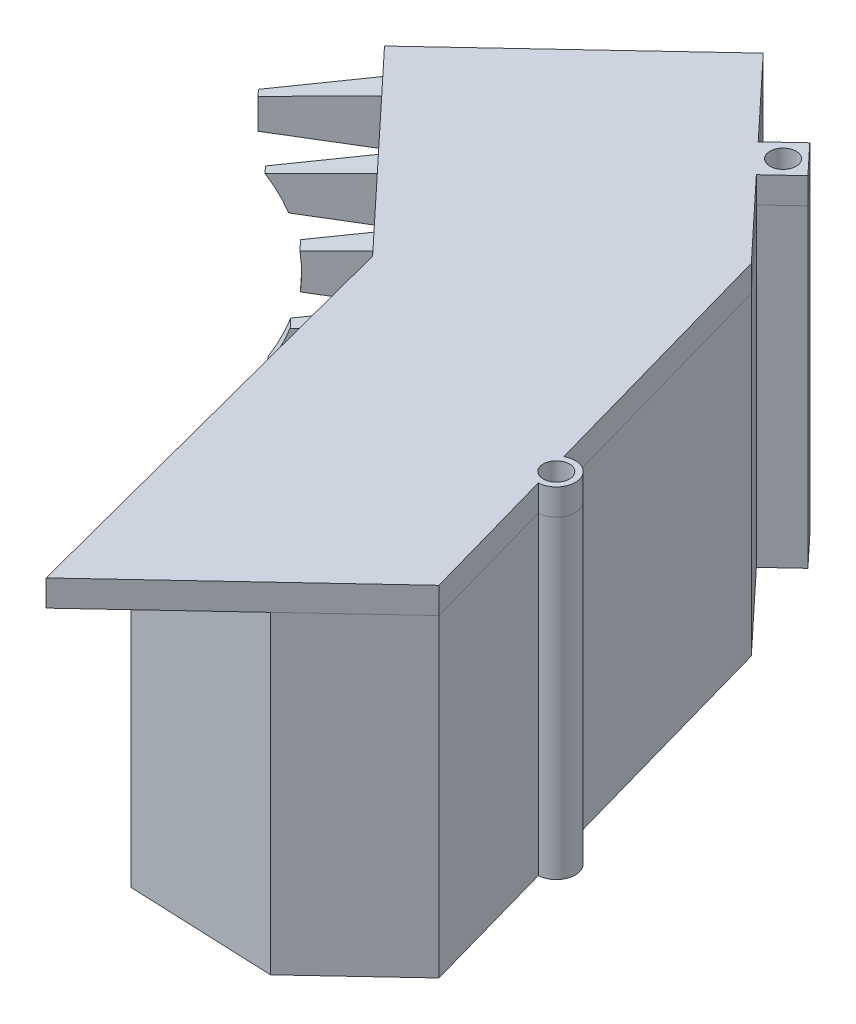
from build123d import *

# Parameters (mm, degrees)
SKETCH1_R                     = 3.175
BOSS_EXTRUDE2_DEPTH           = 76.2
SKETCH1_5_R                   = 3.175
BOSS_EXTRUDE3_DEPTH           = 6.35
SKETCH5_R                     = 3.175
BOSS_EXTRUDE4_DEPTH           = 6.35
SKETCH6_W                     = 50.8
SKETCH6_H                     = 50.8
CUT_EXTRUDE1_DEPTH            = 21.59
SKETCH7_W                     = 5.86068256
SKETCH7_H                     = 11.122345704
BOSS_EXTRUDE5_DEPTH           = 21.59
BOSS_EXTRUDE5_DRAFT           = 5
BOSS_EXTRUDE5_PROFILE_2_DEPTH = 21.59
BOSS_EXTRUDE5_PROFILE_2_DRAFT = 5
BOSS_EXTRUDE5_PROFILE_3_DEPTH = 21.59
BOSS_EXTRUDE5_PROFILE_3_DRAFT = 5
SKETCH7_H_2                   = 11.122345705
BOSS_EXTRUDE5_PROFILE_4_DEPTH = 21.59
BOSS_EXTRUDE5_PROFILE_4_DRAFT = 5
BOSS_EXTRUDE5_PROFILE_5_DEPTH = 21.59
BOSS_EXTRUDE5_PROFILE_5_DRAFT = 5
SKETCH10_R                    = 36.051864109
CUT_EXTRUDE2_DEPTH            = 21.59
CUT_EXTRUDE3_START            = -5.08
SKETCH11_W                    = 102.376221927
SKETCH11_H                    = 148.639543751
CUT_EXTRUDE3_DEPTH            = 33.02


with BuildPart() as part:
    # Sketch1 → Boss-Extrude2 (new body)
    with BuildSketch(Plane(origin=(0, 0, 0), x_dir=(1, 0, 0), z_dir=(0, 1, 0))):
        with BuildLine():
            Line((-4.208751998, -43.475305064), (45.017746951, 2.631829887))
            Line((45.017746951, 2.631829887), (35.550660053, 36.209226482))
            ThreePointArc((35.550660053, 36.209226482), (39.762177432, 42.05307025), (33.11828595, 44.83625091))
            Line((33.11828595, 44.83625091), (15.243844224, 108.232438689))
            Line((15.243844224, 108.232438689), (-2.783728935, 127.479661752))
            Line((-2.783728935, 127.479661752), (3.678966496, 133.532831827))
            Line((3.678966496, 133.532831827), (-3.005742225, 140.669792455))
            Line((-3.005742225, 140.669792455), (-9.468437655, 134.61662238))
            Line((-9.468437655, 134.61662238), (-27.496010814, 153.863845442))
            Line((-27.496010814, 153.863845442), (-74.966911398, 109.401060841))
            Line((-74.966911398, 109.401060841), (-32.227053049, 63.769650553))
            Line((-32.227053049, 63.769650553), (-4.208751998, -43.475305064))
        make_face()
        with Locations((35.334305242, 40.804639607)):
            Circle(SKETCH1_R, mode=Mode.SUBTRACT)
        with BuildLine():
            Line((-27.946524097, 65.532765046), (-68.844709626, 109.197904706))
            Line((-68.844709626, 109.197904706), (-27.496010814, 147.926436632))
            Line((-27.496010814, 147.926436632), (12.111157264, 105.390011693))
            Line((12.111157264, 105.390011693), (34.544848217, 24.491577435))
            ThreePointArc((34.544848217, 24.491577435), (36.285698832, 19.303992732), (36.875100326, 13.863937421))
            ThreePointArc((36.875100326, 13.863937421), (14.585843996, -11.34485616), (-13.162952731, 7.689284266))
            Line((-13.162952731, 7.689284266), (-27.946524097, 65.532765046))
        make_face(mode=Mode.SUBTRACT)
        with Locations((-2.894634056, 134.074815557)):
            Circle(SKETCH1_R, mode=Mode.SUBTRACT)
    extrude(amount=BOSS_EXTRUDE2_DEPTH)

    # Sketch1<5> → Boss-Extrude3 (add)
    with BuildSketch(Plane(origin=(0, 0, 0), x_dir=(1, 0, 0), z_dir=(0, 1, 0))):
        with BuildLine():
            Line((-27.496010814, 147.926436632), (-68.844709626, 109.197904706))
            Line((-68.844709626, 109.197904706), (-27.946524097, 65.532765046))
            Line((-27.946524097, 65.532765046), (-13.162952731, 7.689284266))
            ThreePointArc((-13.162952731, 7.689284266), (3.03743719, 37.821521623), (34.544848217, 24.491577435))
            Line((34.544848217, 24.491577435), (12.111157264, 105.390011693))
            Line((12.111157264, 105.390011693), (-27.496010814, 147.926436632))
        make_face()
        with Locations((-32.808552916, 77.429328599)):
            Circle(SKETCH1_5_R, mode=Mode.SUBTRACT)
        with Locations((-1.199981142, 109.041759799)):
            Circle(SKETCH1_5_R, mode=Mode.SUBTRACT)
    extrude(amount=BOSS_EXTRUDE3_DEPTH)

    # Sketch6 → Cut-Extrude1 (cut)
    with BuildSketch(Plane(origin=(14.64974053, 0, -13.721421958), x_dir=(0.683604049055853, 0, 0.729853070223345), z_dir=(-0.729853070223345, 0, 0.683604049055853))):
        with Locations((-99.833701757, 41.275)):
            Rectangle(SKETCH6_W, SKETCH6_H)
    extrude(amount=-CUT_EXTRUDE1_DEPTH, mode=Mode.SUBTRACT)


with BuildPart() as body_2:
    # Sketch5 → Boss-Extrude4 (new body)
    with BuildSketch(Plane(origin=(0, 76.2, 0), x_dir=(1, 0, 0), z_dir=(0, 1, 0))):
        with BuildLine():
            Line((45.017746951, 2.631829887), (35.550660053, 36.209226482))
            ThreePointArc((35.550660053, 36.209226482), (39.762177432, 42.05307025), (33.11828595, 44.83625091))
            Line((33.11828595, 44.83625091), (15.243844224, 108.232438689))
            Line((15.243844224, 108.232438689), (-2.783728935, 127.479661752))
            Line((-2.783728935, 127.479661752), (3.678966496, 133.532831827))
            Line((3.678966496, 133.532831827), (-3.005742225, 140.669792455))
            Line((-3.005742225, 140.669792455), (-9.468437655, 134.61662238))
            Line((-9.468437655, 134.61662238), (-27.496010814, 153.863845442))
            Line((-27.496010814, 153.863845442), (-74.966911398, 109.401060841))
            Line((-74.966911398, 109.401060841), (-32.227053049, 63.769650553))
            Line((-32.227053049, 63.769650553), (-4.208751998, -43.475305064))
            Line((-4.208751998, -43.475305064), (45.017746951, 2.631829887))
        make_face()
        with Locations((-2.894634056, 134.074815557)):
            Circle(SKETCH5_R, mode=Mode.SUBTRACT)
        with Locations((35.334305242, 40.804639607)):
            Circle(SKETCH5_R, mode=Mode.SUBTRACT)
    extrude(amount=BOSS_EXTRUDE4_DEPTH)


with BuildPart() as boss_extrude5_tool:
    # Sketch7 → Boss-Extrude5 (with draft: the straight prism first)
    with BuildSketch(Plane(origin=(14.64974053, 0, -13.721421958), x_dir=(0.683604049055853, 0, 0.729853070223345), z_dir=(-0.729853070223345, 0, 0.683604049055853))):
        with Locations((-128.164043037, 70.606947953)):
            Rectangle(SKETCH7_W, SKETCH7_H)
    extrude(amount=BOSS_EXTRUDE5_DEPTH)
    # Boss-Extrude5: the draft: its side faces are tilted about the plane it starts from
    boss_extrude5_sides = [boss_extrude5_tool.faces().sort_by_distance(p)[0] for p in [
        (-82.845675291, 70.606947953, -102.021555132),
        (-80.842482126, 65.045775101, -99.882836552),
        (-78.839288962, 70.606947953, -97.744117972),
        (-80.842482126, 76.168120805, -99.882836552),
    ]]
    draft(boss_extrude5_sides, Plane(origin=(14.64974053, 0, -13.721421958), x_dir=(0.683604049055853, 0, 0.729853070223345), z_dir=(-0.729853070223345, 0, 0.683604049055853)), BOSS_EXTRUDE5_DRAFT)


with BuildPart() as part_1:
    add(part.part)

    # Boss-Extrude5: add boss_extrude5_tool
    add(boss_extrude5_tool.part)


with BuildPart() as boss_extrude5_profile_2_tool:
    # Sketch7 → Boss-Extrude5 profile 2 (with draft: the straight prism first)
    with BuildSketch(Plane(origin=(14.64974053, 0, -13.721421958), x_dir=(0.683604049055853, 0, 0.729853070223345), z_dir=(-0.729853070223345, 0, 0.683604049055853))):
        with Locations((-128.164043037, 54.345504178)):
            Rectangle(SKETCH7_W, SKETCH7_H)
    extrude(amount=BOSS_EXTRUDE5_PROFILE_2_DEPTH)
    # Boss-Extrude5 profile 2: the draft: its side faces are tilted about the plane it starts from
    boss_extrude5_profile_2_sides = [boss_extrude5_profile_2_tool.faces().sort_by_distance(p)[0] for p in [
        (-80.842482126, 48.784331326, -99.882836552),
        (-78.839288962, 54.345504178, -97.744117972),
        (-80.842482126, 59.90667703, -99.882836552),
        (-82.845675291, 54.345504178, -102.021555132),
    ]]
    draft(boss_extrude5_profile_2_sides, Plane(origin=(14.64974053, 0, -13.721421958), x_dir=(0.683604049055853, 0, 0.729853070223345), z_dir=(-0.729853070223345, 0, 0.683604049055853)), BOSS_EXTRUDE5_PROFILE_2_DRAFT)


with BuildPart() as part_2:
    add(part_1.part)

    # Boss-Extrude5 profile 2: add boss_extrude5_profile_2_tool
    add(boss_extrude5_profile_2_tool.part)


with BuildPart() as boss_extrude5_profile_3_tool:
    # Sketch7 → Boss-Extrude5 profile 3 (with draft: the straight prism first)
    with BuildSketch(Plane(origin=(14.64974053, 0, -13.721421958), x_dir=(0.683604049055853, 0, 0.729853070223345), z_dir=(-0.729853070223345, 0, 0.683604049055853))):
        with Locations((-128.164043037, 38.084060403)):
            Rectangle(SKETCH7_W, SKETCH7_H)
    extrude(amount=BOSS_EXTRUDE5_PROFILE_3_DEPTH)
    # Boss-Extrude5 profile 3: the draft: its side faces are tilted about the plane it starts from
    boss_extrude5_profile_3_sides = [boss_extrude5_profile_3_tool.faces().sort_by_distance(p)[0] for p in [
        (-80.842482126, 32.522887551, -99.882836552),
        (-78.839288962, 38.084060403, -97.744117972),
        (-80.842482126, 43.645233255, -99.882836552),
        (-82.845675291, 38.084060403, -102.021555132),
    ]]
    draft(boss_extrude5_profile_3_sides, Plane(origin=(14.64974053, 0, -13.721421958), x_dir=(0.683604049055853, 0, 0.729853070223345), z_dir=(-0.729853070223345, 0, 0.683604049055853)), BOSS_EXTRUDE5_PROFILE_3_DRAFT)


with BuildPart() as part_3:
    add(part_2.part)

    # Boss-Extrude5 profile 3: add boss_extrude5_profile_3_tool
    add(boss_extrude5_profile_3_tool.part)


with BuildPart() as boss_extrude5_profile_4_tool:
    # Sketch7 → Boss-Extrude5 profile 4 (with draft: the straight prism first)
    with BuildSketch(Plane(origin=(14.64974053, 0, -13.721421958), x_dir=(0.683604049055853, 0, 0.729853070223345), z_dir=(-0.729853070223345, 0, 0.683604049055853))):
        with Locations((-128.164043037, 21.822616628)):
            Rectangle(SKETCH7_W, SKETCH7_H_2)
    extrude(amount=BOSS_EXTRUDE5_PROFILE_4_DEPTH)
    # Boss-Extrude5 profile 4: the draft: its side faces are tilted about the plane it starts from
    boss_extrude5_profile_4_sides = [boss_extrude5_profile_4_tool.faces().sort_by_distance(p)[0] for p in [
        (-80.842482126, 16.261443775, -99.882836552),
        (-78.839288962, 21.822616627, -97.744117972),
        (-80.842482126, 27.38378948, -99.882836552),
        (-82.845675291, 21.822616627, -102.021555132),
    ]]
    draft(boss_extrude5_profile_4_sides, Plane(origin=(14.64974053, 0, -13.721421958), x_dir=(0.683604049055853, 0, 0.729853070223345), z_dir=(-0.729853070223345, 0, 0.683604049055853)), BOSS_EXTRUDE5_PROFILE_4_DRAFT)


with BuildPart() as part_4:
    add(part_3.part)

    # Boss-Extrude5 profile 4: add boss_extrude5_profile_4_tool
    add(boss_extrude5_profile_4_tool.part)


with BuildPart() as boss_extrude5_profile_5_tool:
    # Sketch7 → Boss-Extrude5 profile 5 (with draft: the straight prism first)
    with BuildSketch(Plane(origin=(14.64974053, 0, -13.721421958), x_dir=(0.683604049055853, 0, 0.729853070223345), z_dir=(-0.729853070223345, 0, 0.683604049055853))):
        with Locations((-128.164043037, 5.561172852)):
            Rectangle(SKETCH7_W, SKETCH7_H)
    extrude(amount=BOSS_EXTRUDE5_PROFILE_5_DEPTH)
    # Boss-Extrude5 profile 5: the draft: its side faces are tilted about the plane it starts from
    boss_extrude5_profile_5_sides = [boss_extrude5_profile_5_tool.faces().sort_by_distance(p)[0] for p in [
        (-80.842482126, 0, -99.882836552),
        (-78.839288962, 5.561172852, -97.744117972),
        (-80.842482126, 11.122345704, -99.882836552),
        (-82.845675291, 5.561172852, -102.021555132),
    ]]
    draft(boss_extrude5_profile_5_sides, Plane(origin=(14.64974053, 0, -13.721421958), x_dir=(0.683604049055853, 0, 0.729853070223345), z_dir=(-0.729853070223345, 0, 0.683604049055853)), BOSS_EXTRUDE5_PROFILE_5_DRAFT)


with BuildPart() as part_5:
    add(part_4.part)

    # Boss-Extrude5 profile 5: add boss_extrude5_profile_5_tool
    add(boss_extrude5_profile_5_tool.part)

    # Sketch10 → Cut-Extrude2 (cut)
    with BuildSketch(Plane(origin=(-89.616651928, 0, -95.679638883), x_dir=(-0.7298530702233451, 0, 0.683604049055853), z_dir=(-0.683604049055853, 0, -0.7298530702233451))):
        with Locations((30.057024975, 37.74518963)):
            Circle(SKETCH10_R)
    extrude(amount=-CUT_EXTRUDE2_DEPTH, mode=Mode.SUBTRACT)

    # Sketch11 → Cut-Extrude3 (cut)
    with BuildSketch(Plane(origin=(-0.455771155, 0, 11.066213292), x_dir=(0, -1, 0), z_dir=(0.04115094100910027, 0, -0.9991529412727892)).offset(CUT_EXTRUDE3_START)):
        with Locations((-28.770085538, 5.325235466)):
            Rectangle(SKETCH11_W, SKETCH11_H)
    extrude(amount=-CUT_EXTRUDE3_DEPTH, mode=Mode.SUBTRACT)


solid = Compound([body_2.part, part_5.part])
